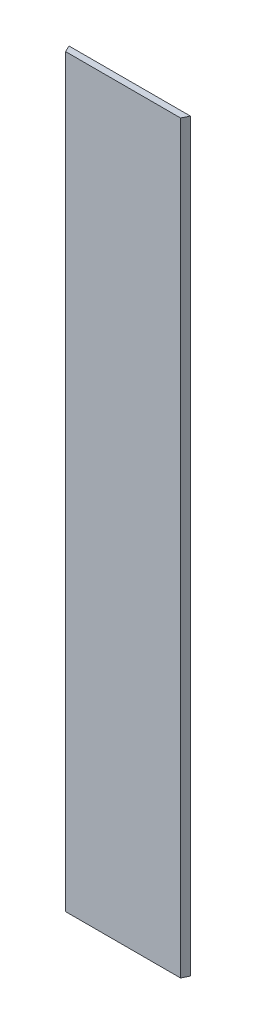
from build123d import *

# Parameters (mm, degrees)
BOSS_EXTRUDE1_DEPTH = 539.75


with BuildPart() as part:
    # Sketch1 → Boss-Extrude1 (new body)
    with BuildSketch(Plane(origin=(0, 0, 0), x_dir=(1, 0, 0), z_dir=(0, 1, 0))):
        with BuildLine():
            Line((-41.610132225, -23.297852443), (41.610132225, -23.297852443))
            ThreePointArc((41.610132225, -23.297852443), (42.840785409, -20.948988945), (43.938977481, -18.535352443))
            Line((43.938977481, -18.535352443), (-43.938977481, -18.535352443))
            ThreePointArc((-43.938977481, -18.535352443), (-42.840785409, -20.948988945), (-41.610132225, -23.297852443))
        make_face()
    extrude(amount=BOSS_EXTRUDE1_DEPTH)


solid = part.part
